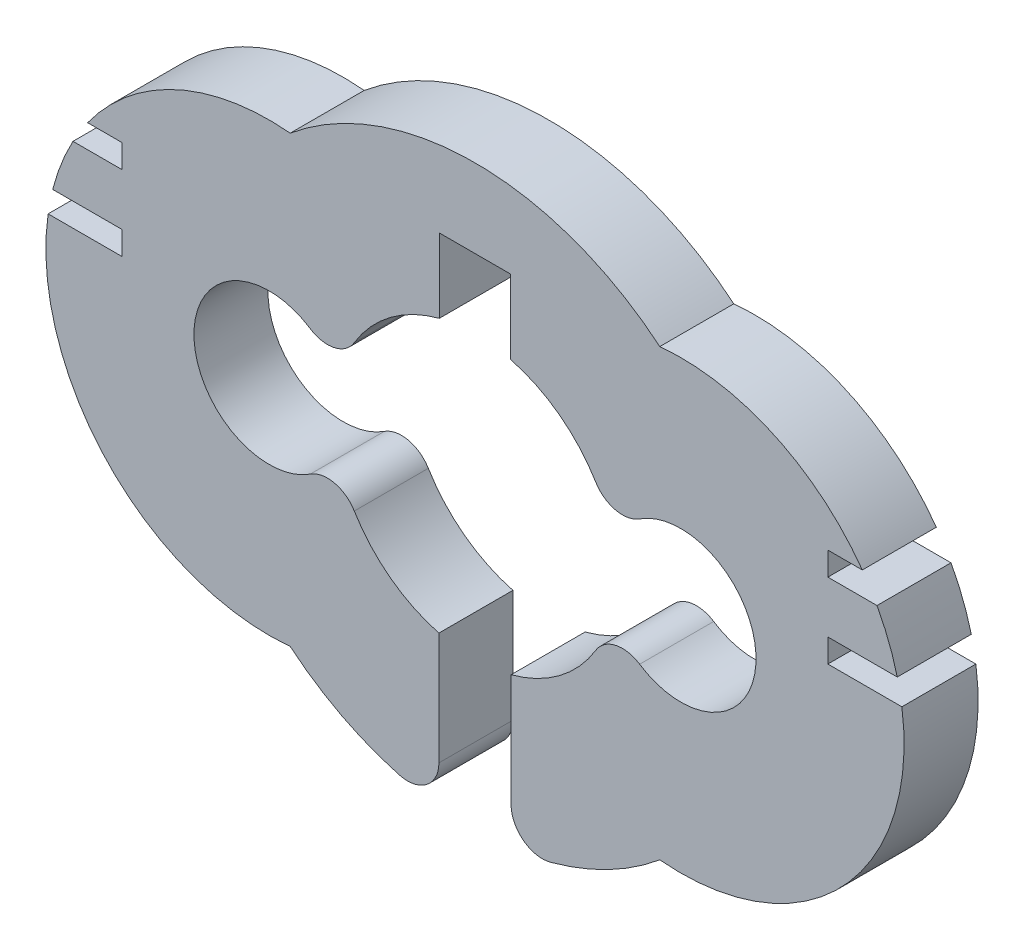
from build123d import *

# Parameters (mm, degrees)
EXTRUDE_1_DEPTH     = 3
SKETCH_2_W          = 3
SKETCH_2_H          = 0.95
CUT_EXTRUDE_1_DEPTH = 3
FILLET_1_R          = 1.27


with BuildPart() as part:
    # 스케치1 → 보스-돌출1 (new body)
    with BuildSketch(Plane.XY):
        with BuildLine():
            Line((-1.4475, 8.528649813), (1.4475, 8.528649813))
            Line((1.4475, 8.528649813), (1.4475, 5.528649813))
            ThreePointArc((1.4475, 5.528649813), (4.105207543, 3.975989943), (5.572102386, 1.27))
            ThreePointArc((5.572102386, 1.27), (11.390915263, 0), (5.572102386, -1.27))
            ThreePointArc((5.572102386, -1.27), (4.110599393, -3.970415297), (1.4625, -5.524700784))
            Line((1.4625, -5.524700784), (1.4625, -11.623352303))
            ThreePointArc((1.4625, -11.623352303), (4.663454339, -10.746786433), (7.490136969, -9.007722974))
            ThreePointArc((7.490136969, -9.007722974), (17.390915263, 0), (7.490136969, 9.007722974))
            ThreePointArc((7.490136969, 9.007722974), (0, 11.715), (-7.490136969, 9.007722974))
            ThreePointArc((-7.490136969, 9.007722974), (-17.390915263, 0), (-7.490136969, -9.007722974))
            ThreePointArc((-7.490136969, -9.007722974), (-4.663454339, -10.746786433), (-1.4625, -11.623352303))
            Line((-1.4625, -11.623352303), (-1.4625, -5.524700784))
            ThreePointArc((-1.4625, -5.524700784), (-4.110599393, -3.970415297), (-5.572102386, -1.27))
            ThreePointArc((-5.572102386, -1.27), (-11.390915263, 0), (-5.572102386, 1.27))
            ThreePointArc((-5.572102386, 1.27), (-4.105207543, 3.975989943), (-1.4475, 5.528649813))
            Line((-1.4475, 5.528649813), (-1.4475, 8.528649813))
        make_face()
    extrude(amount=EXTRUDE_1_DEPTH)

    # 스케치2 → 컷-돌출1 (cut)
    with BuildSketch(Plane.XY.offset(3)):
        with Locations((15.801341687, 1.745)):
            Rectangle(SKETCH_2_W, SKETCH_2_H)
        with Locations((-15.801341687, 4.795)):
            Rectangle(SKETCH_2_W, SKETCH_2_H)
        with Locations((-15.801341687, 1.745)):
            Rectangle(SKETCH_2_W, SKETCH_2_H)
        with Locations((15.801341687, 4.795)):
            Rectangle(SKETCH_2_W, SKETCH_2_H)
    extrude(amount=-CUT_EXTRUDE_1_DEPTH, mode=Mode.SUBTRACT)

    # 필렛1
    fillet_1_edges = [part.edges().sort_by_distance(p)[0] for p in [
        (-5.572102386, 1.27, 1.5),
        (-5.572102386, -1.27, 1.5),
        (-1.4625, -11.623352303, 1.5),
        (1.4625, -11.623352303, 1.5),
        (5.572102386, -1.27, 1.5),
        (5.572102386, 1.27, 1.5),
    ]]
    fillet(fillet_1_edges, radius=FILLET_1_R)


solid = part.part
